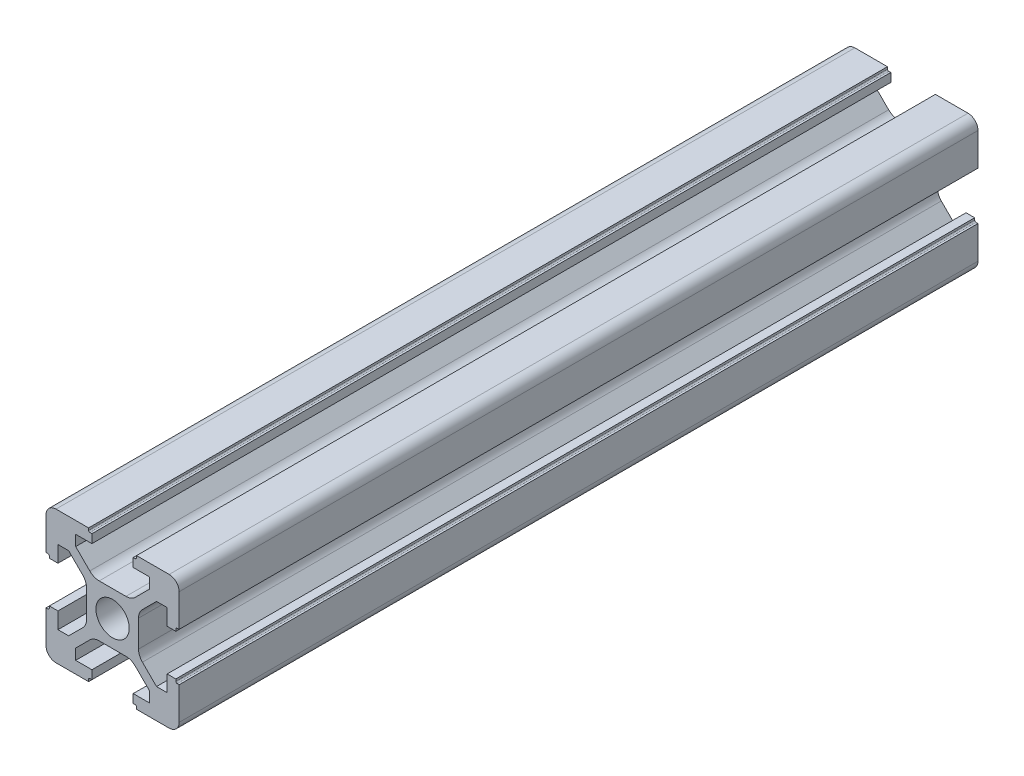
from build123d import *

# Parameters (mm, degrees)
SKETCH1_R       = 2.5
EXTRUDE_1_DEPTH = 120


with BuildPart() as part:
    # Sketch1 → Бобышка-Вытянуть1 (new body)
    with BuildSketch(Plane.XY):
        with BuildLine():
            Line((0, 3.9), (-2.010912703, 3.9))
            ThreePointArc((-2.010912703, 3.9), (-2.776279568, 4.052240935), (-3.425126266, 4.485786438))
            Line((-3.425126266, 4.485786438), (-5.539339828, 6.6))
            Line((-5.539339828, 6.6), (-5.539339828, 8.2))
            Line((-5.539339828, 8.2), (-3.1, 8.2))
            Line((-3.1, 8.2), (-3.1, 9.5))
            Line((-3.1, 9.5), (-3.4, 9.5))
            ThreePointArc((-3.4, 9.5), (-3.541421356, 9.558578644), (-3.6, 9.7))
            Line((-3.6, 9.7), (-3.6, 10))
            Line((-3.6, 10), (-8.5, 10))
            ThreePointArc((-8.5, 10), (-9.560660172, 9.560660172), (-10, 8.5))
            Line((-10, 8.5), (-10, 3.6))
            Line((-10, 3.6), (-9.7, 3.6))
            ThreePointArc((-9.7, 3.6), (-9.558578644, 3.541421356), (-9.5, 3.4))
            Line((-9.5, 3.4), (-9.5, 3.1))
            Line((-9.5, 3.1), (-8.2, 3.1))
            Line((-8.2, 3.1), (-8.2, 5.539339828))
            Line((-8.2, 5.539339828), (-6.6, 5.539339828))
            Line((-6.6, 5.539339828), (-4.485786438, 3.425126266))
            ThreePointArc((-4.485786438, 3.425126266), (-4.052240935, 2.776279568), (-3.9, 2.010912703))
            Line((-3.9, 2.010912703), (-3.9, 0))
            Line((-3.9, 0), (-3.9, -2.010912703))
            ThreePointArc((-3.9, -2.010912703), (-4.052240935, -2.776279568), (-4.485786438, -3.425126266))
            Line((-4.485786438, -3.425126266), (-6.6, -5.539339828))
            Line((-6.6, -5.539339828), (-8.2, -5.539339828))
            Line((-8.2, -5.539339828), (-8.2, -3.1))
            Line((-8.2, -3.1), (-9.5, -3.1))
            Line((-9.5, -3.1), (-9.5, -3.4))
            ThreePointArc((-9.5, -3.4), (-9.558578644, -3.541421356), (-9.7, -3.6))
            Line((-9.7, -3.6), (-10, -3.6))
            Line((-10, -3.6), (-10, -8.5))
            ThreePointArc((-10, -8.5), (-9.560660172, -9.560660172), (-8.5, -10))
            Line((-8.5, -10), (-3.6, -10))
            Line((-3.6, -10), (-3.6, -9.7))
            ThreePointArc((-3.6, -9.7), (-3.541421356, -9.558578644), (-3.4, -9.5))
            Line((-3.4, -9.5), (-3.1, -9.5))
            Line((-3.1, -9.5), (-3.1, -8.2))
            Line((-3.1, -8.2), (-5.539339828, -8.2))
            Line((-5.539339828, -8.2), (-5.539339828, -6.6))
            Line((-5.539339828, -6.6), (-3.425126266, -4.485786438))
            ThreePointArc((-3.425126266, -4.485786438), (-2.776279568, -4.052240935), (-2.010912703, -3.9))
            Line((-2.010912703, -3.9), (0, -3.9))
            Line((0, -3.9), (2.010912703, -3.9))
            ThreePointArc((2.010912703, -3.9), (2.776279568, -4.052240935), (3.425126266, -4.485786438))
            Line((3.425126266, -4.485786438), (5.539339828, -6.6))
            Line((5.539339828, -6.6), (5.539339828, -8.2))
            Line((5.539339828, -8.2), (3.1, -8.2))
            Line((3.1, -8.2), (3.1, -9.5))
            Line((3.1, -9.5), (3.4, -9.5))
            ThreePointArc((3.4, -9.5), (3.541421356, -9.558578644), (3.6, -9.7))
            Line((3.6, -9.7), (3.6, -10))
            Line((3.6, -10), (8.5, -10))
            ThreePointArc((8.5, -10), (9.560660172, -9.560660172), (10, -8.5))
            Line((10, -8.5), (10, -3.6))
            Line((10, -3.6), (9.7, -3.6))
            ThreePointArc((9.7, -3.6), (9.558578644, -3.541421356), (9.5, -3.4))
            Line((9.5, -3.4), (9.5, -3.1))
            Line((9.5, -3.1), (8.2, -3.1))
            Line((8.2, -3.1), (8.2, -5.539339828))
            Line((8.2, -5.539339828), (6.6, -5.539339828))
            Line((6.6, -5.539339828), (4.485786438, -3.425126266))
            ThreePointArc((4.485786438, -3.425126266), (4.052240935, -2.776279568), (3.9, -2.010912703))
            Line((3.9, -2.010912703), (3.9, 0))
            Line((3.9, 0), (3.9, 2.010912703))
            ThreePointArc((3.9, 2.010912703), (4.052240935, 2.776279568), (4.485786438, 3.425126266))
            Line((4.485786438, 3.425126266), (6.6, 5.539339828))
            Line((6.6, 5.539339828), (8.2, 5.539339828))
            Line((8.2, 5.539339828), (8.2, 3.1))
            Line((8.2, 3.1), (9.5, 3.1))
            Line((9.5, 3.1), (9.5, 3.4))
            ThreePointArc((9.5, 3.4), (9.558578644, 3.541421356), (9.7, 3.6))
            Line((9.7, 3.6), (10, 3.6))
            Line((10, 3.6), (10, 8.5))
            ThreePointArc((10, 8.5), (9.560660172, 9.560660172), (8.5, 10))
            Line((8.5, 10), (3.6, 10))
            Line((3.6, 10), (3.6, 9.7))
            ThreePointArc((3.6, 9.7), (3.541421356, 9.558578644), (3.4, 9.5))
            Line((3.4, 9.5), (3.1, 9.5))
            Line((3.1, 9.5), (3.1, 8.2))
            Line((3.1, 8.2), (5.539339828, 8.2))
            Line((5.539339828, 8.2), (5.539339828, 6.6))
            Line((5.539339828, 6.6), (3.425126266, 4.485786438))
            ThreePointArc((3.425126266, 4.485786438), (2.776279568, 4.052240935), (2.010912703, 3.9))
            Line((2.010912703, 3.9), (0, 3.9))
        make_face()
        Circle(SKETCH1_R, mode=Mode.SUBTRACT)
    extrude(amount=EXTRUDE_1_DEPTH)


solid = part.part
